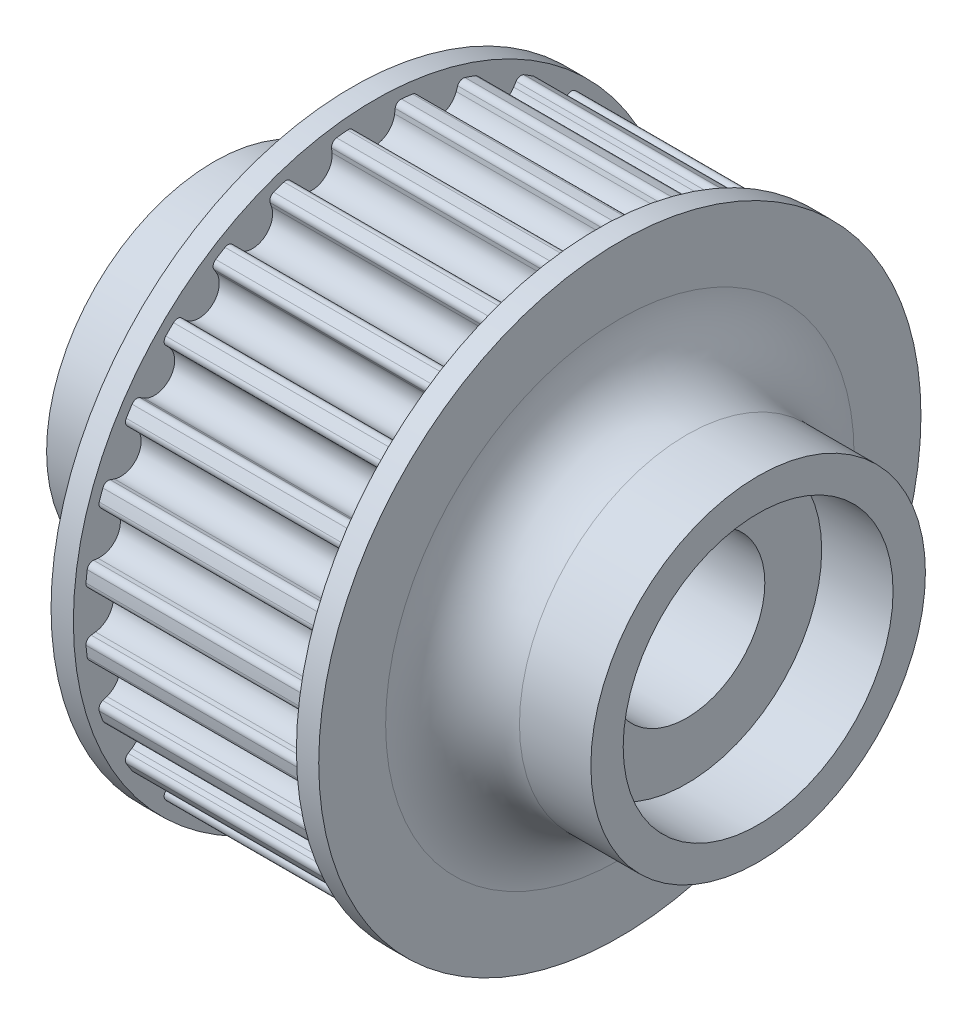
from build123d import *

# Parameters (mm, degrees)
CUT_EXTRUDE_2_REACH      = 23.309
PATTERN_CIRCULAR_3_COUNT = 28
SKETCH_7_R               = 2.5978
EXTRUDE_1_DEPTH          = 10.8
SKETCH_8_R               = 13.5
EXTRUDE_2_DEPTH          = 1
EXTRUDE_START            = 1
SKETCH_9_R               = 13.5
EXTRUDE_3_DEPTH          = 1
SKETCH_10_R              = 7.5
EXTRUDE_4_DEPTH          = 6.2
EXTRUDE_START_2          = 6.2
SKETCH_11_R              = 7.5
EXTRUDE_5_DEPTH          = 6.2
SKETCH_12_R              = 3.5
CUT_EXTRUDE_3_DEPTH      = 31
FILLET_1_R               = 3
SKETCH_13_R              = 6.05
CUT_EXTRUDE_4_DEPTH      = 3.2
CUT_EXTRUDE_START        = -3.2
SKETCH_14_R              = 6.05
CUT_EXTRUDE_5_DEPTH      = 3.2


with BuildPart() as part:
    # 草图1 → 旋转1 (revolve)
    with BuildSketch(Plane.XY, mode=Mode.PRIVATE) as revolve_1_sk:
        Polygon((0, 2.5978), (0, 12.989), (10, 12.989), (10, 5.1956), (10.8, 5.1956), (10.8, 2.5978), align=None)
    revolve(revolve_1_sk.sketch.rotate(Axis((0, 0, 0), (1, 0, 0)), 90), axis=Axis((0, 0, 0), (1, 0, 0)))

    # 草图6 → 切除-拉伸2 (cut, up to next)
    with BuildSketch(Plane(origin=(0, 0, 0), x_dir=(0, 0, -1), z_dir=(1, 0, 0)), mode=Mode.PRIVATE) as cut_extrude_2_sk1:
        with BuildLine():
            Line((0.92743771, 12.70536077), (0.903216998, 12.508098898))
            ThreePointArc((0.903216998, 12.508098898), (0, 11.709), (-0.903216998, 12.508098898))
            Line((-0.903216998, 12.508098898), (-0.92743771, 12.70536077))
            ThreePointArc((-0.92743771, 12.70536077), (-1.022483568, 12.876222852), (-1.209714489, 12.932544678))
            ThreePointArc((-1.209714489, 12.932544678), (-1.339088868, 12.91978955), (-1.468329108, 12.90574022))
            Line((-1.468329108, 12.90574022), (-1.664977096, 14.507309562))
            ThreePointArc((-1.664977096, 14.507309562), (0, 14.602540172), (1.664977096, 14.507309562))
            Line((1.664977096, 14.507309562), (1.468329108, 12.90574022))
            ThreePointArc((1.468329108, 12.90574022), (1.339088868, 12.91978955), (1.209714489, 12.932544678))
            ThreePointArc((1.209714489, 12.932544678), (1.022483568, 12.876222852), (0.92743771, 12.70536077))
        make_face()
    cut_extrude_2_tool1 = extrude(cut_extrude_2_sk1.sketch, amount=CUT_EXTRUDE_2_REACH, mode=Mode.PRIVATE) & part.part
    cut_extrude_2 = cut_extrude_2_tool1.solids().sort_by_distance((0, 13.400539, 0))[0]
    add(cut_extrude_2, mode=Mode.SUBTRACT)

    # 阵列(圆周)3: 切除-拉伸2 ×28 about axis
    pattern_circular_3_axis = Axis((0, 0, 0), (1, 0, 0))
    for i in range(1, PATTERN_CIRCULAR_3_COUNT):
        add(cut_extrude_2.rotate(pattern_circular_3_axis, i * 360 / PATTERN_CIRCULAR_3_COUNT), mode=Mode.SUBTRACT)

    # 草图7 → 凸台-拉伸1 (add)
    with BuildSketch(Plane.ZY):
        Circle(SKETCH_7_R)
    extrude(amount=-EXTRUDE_1_DEPTH)

    # 草图8 → 凸台-拉伸2 (add)
    with BuildSketch(Plane.ZY):
        Circle(SKETCH_8_R)
    extrude(amount=EXTRUDE_2_DEPTH)

    # 草图9 → 凸台-拉伸3 (add)
    with BuildSketch(Plane(origin=(10, 0, 0), x_dir=(0, 0, -1), z_dir=(1, 0, 0)).offset(EXTRUDE_START)):
        with Locations(Location((0, 0, 0), (0, 0, 180))):
            Circle(SKETCH_9_R)
    extrude(amount=-EXTRUDE_3_DEPTH)

    # 草图10 → 凸台-拉伸4 (add)
    with BuildSketch(Plane.ZY.offset(1)):
        with Locations(Location((0, 0, 0), (0, 0, 180))):
            Circle(SKETCH_10_R)
    extrude(amount=EXTRUDE_4_DEPTH)

    # 草图11 → 凸台-拉伸5 (add)
    with BuildSketch(Plane(origin=(11, 0, 0), x_dir=(0, 0, -1), z_dir=(1, 0, 0)).offset(EXTRUDE_START_2)):
        Circle(SKETCH_11_R)
    extrude(amount=-EXTRUDE_5_DEPTH)

    # 草图12 → 切除-拉伸3 (cut)
    with BuildSketch(Plane.ZY.offset(7.2)):
        Circle(SKETCH_12_R)
    extrude(amount=-CUT_EXTRUDE_3_DEPTH, mode=Mode.SUBTRACT)

    # 圆角1
    fillet_1_edges = [part.edges().sort_by_distance(p)[0] for p in [
        (-1, 0, 7.5),
        (11, 0, 7.5),
    ]]
    fillet(fillet_1_edges, radius=FILLET_1_R)

    # 草图13 → 切除-拉伸4 (cut)
    with BuildSketch(Plane(origin=(17.2, 0, 0), x_dir=(0, 0, -1), z_dir=(1, 0, 0))):
        Circle(SKETCH_13_R)
    extrude(amount=-CUT_EXTRUDE_4_DEPTH, mode=Mode.SUBTRACT)

    # 草图14 → 切除-拉伸5 (cut)
    with BuildSketch(Plane.ZY.offset(7.2).offset(CUT_EXTRUDE_START)):
        with Locations(Location((0, 0, 0), (0, 0, 180))):
            Circle(SKETCH_14_R)
    extrude(amount=CUT_EXTRUDE_5_DEPTH, mode=Mode.SUBTRACT)


solid = part.part
